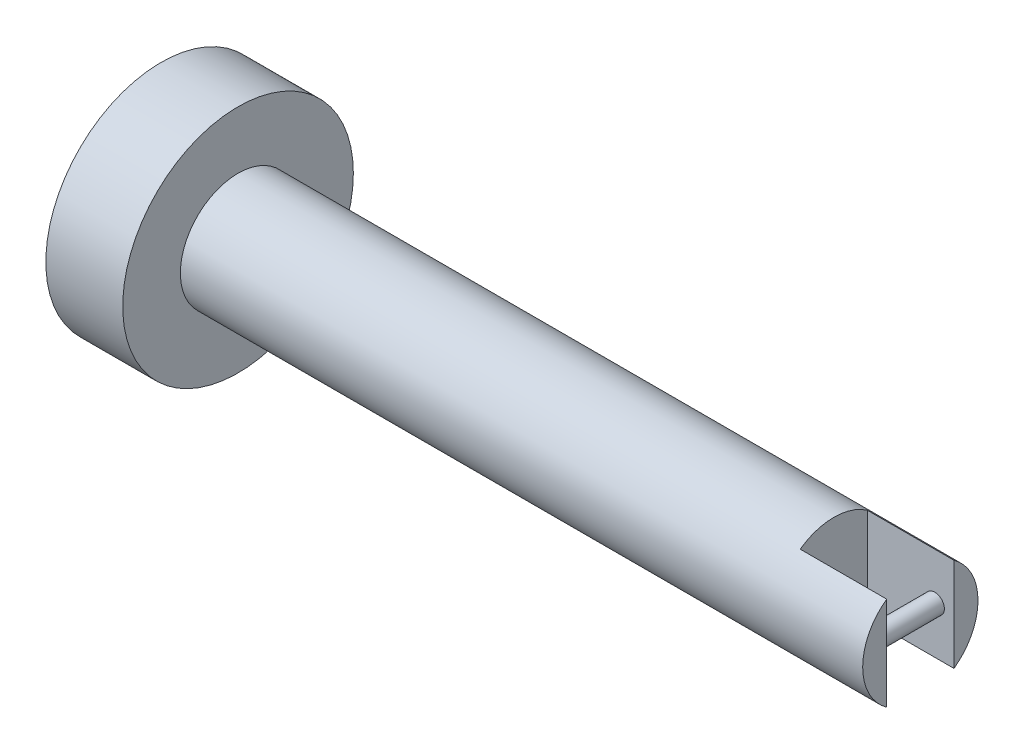
from build123d import *

# Parameters (mm, degrees)
SKETCH1_R           = 60
BOSS_EXTRUDE1_DEPTH = 40
SKETCH2_R           = 30
BOSS_EXTRUDE2_DEPTH = 355
SKETCH3_W           = 35
SKETCH3_H           = 68.96676223
CUT_EXTRUDE1_DEPTH  = 45
SKETCH4_R           = 5
BOSS_EXTRUDE3_DEPTH = 35


with BuildPart() as part:
    # Sketch1 → Boss-Extrude1 (new body)
    with BuildSketch(Plane(origin=(0, 0, 0), x_dir=(0, 0, -1), z_dir=(1, 0, 0))):
        Circle(SKETCH1_R)
    extrude(amount=BOSS_EXTRUDE1_DEPTH)

    # Sketch2 → Boss-Extrude2 (add)
    with BuildSketch(Plane(origin=(40, 0, 0), x_dir=(0, 0, -1), z_dir=(1, 0, 0))):
        Circle(SKETCH2_R)
    extrude(amount=BOSS_EXTRUDE2_DEPTH)

    # Sketch3 → Cut-Extrude1 (cut)
    with BuildSketch(Plane(origin=(395, 0, 0), x_dir=(0, 0, -1), z_dir=(1, 0, 0))):
        Rectangle(SKETCH3_W, SKETCH3_H)
    extrude(amount=-CUT_EXTRUDE1_DEPTH, mode=Mode.SUBTRACT)

    # Sketch4 → Boss-Extrude3 (add)
    with BuildSketch(Plane.XY.offset(-17.5)):
        with Locations(Location((385, 0, 0), (0, 0, 180))):
            Circle(SKETCH4_R)
    extrude(amount=BOSS_EXTRUDE3_DEPTH)


solid = part.part
